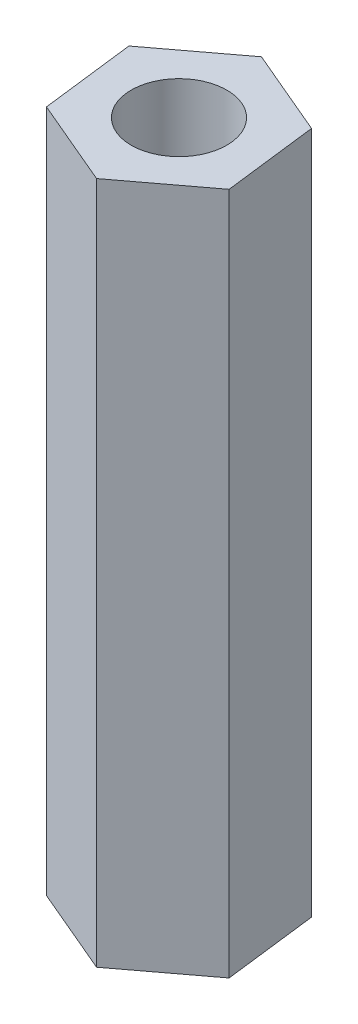
from build123d import *

# Parameters (mm, degrees)
SKETCH_1_R      = 2.1
EXTRUDE_1_DEPTH = 30


with BuildPart() as part:
    # 草图1 → 凸台-拉伸1 (new body)
    with BuildSketch(Plane(origin=(0, 0, 0), x_dir=(1, 0, 0), z_dir=(0, 1, 0))):
        Polygon((3.320611657, 2.500707544), (-0.505370432, 4.126087823), (-3.825982089, 1.625380279), (-3.320611657, -2.500707544), (0.505370432, -4.126087823), (3.825982089, -1.625380279), align=None)
        with Locations(Location((0, 0, 0), (0, 0, 270))):
            Circle(SKETCH_1_R, mode=Mode.SUBTRACT)
    extrude(amount=EXTRUDE_1_DEPTH)


solid = part.part
